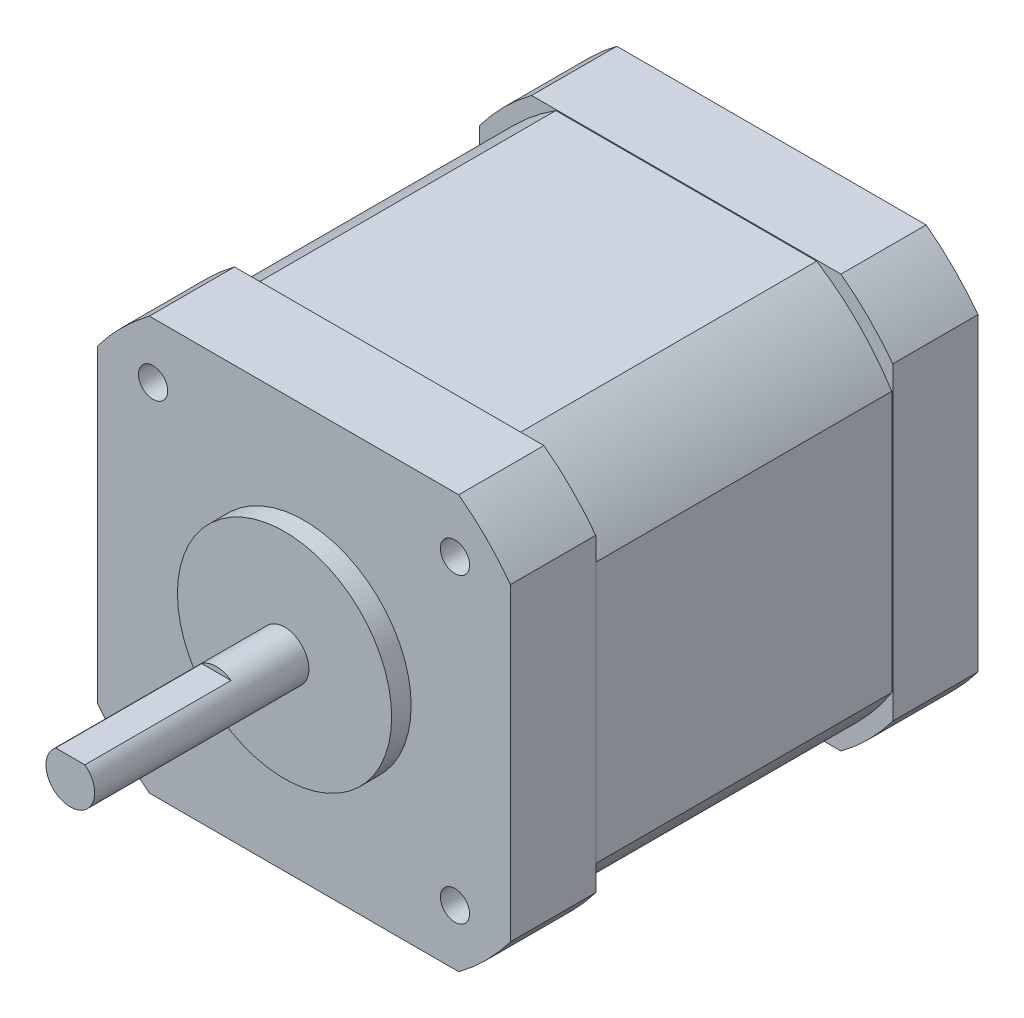
from build123d import *

# Parameters (mm, degrees)
BOSS_EXTRUDE1_DEPTH             = 8.75
BOSS_EXTRUDE2_DEPTH             = 30.5
BOSS_EXTRUDE3_DEPTH             = 8.75
SKETCH4_R                       = 11
BOSS_EXTRUDE4_DEPTH             = 2
SKETCH5_R                       = 2.5
BOSS_EXTRUDE5_DEPTH             = 22
CUT_EXTRUDE1_START              = -15
CUT_EXTRUDE1_DEPTH              = 15
M3X0_5_TAPPED_HOLE1_D           = 2.5
M3X0_5_TAPPED_HOLE1_DEPTH       = 7.5
M3X0_5_TAPPED_HOLE1_CBORE_D     = 3
M3X0_5_TAPPED_HOLE1_CBORE_DEPTH = 6
M3X0_5_TAPPED_HOLE1_TIP         = 0.751075774


with BuildPart() as part:
    # Sketch1 → Boss-Extrude1 (new body)
    with BuildSketch(Plane.XY):
        with BuildLine():
            Line((-21.209, 15.887992919), (-21.209, -15.887992919))
            ThreePointArc((-21.209, -15.887992919), (-18.738329701, -18.738329701), (-15.887992919, -21.209))
            Line((-15.887992919, -21.209), (15.887992919, -21.209))
            ThreePointArc((15.887992919, -21.209), (18.738329701, -18.738329701), (21.209, -15.887992919))
            Line((21.209, -15.887992919), (21.209, 15.887992919))
            ThreePointArc((21.209, 15.887992919), (18.738329701, 18.738329701), (15.887992919, 21.209))
            Line((15.887992919, 21.209), (-15.887992919, 21.209))
            ThreePointArc((-15.887992919, 21.209), (-18.738329701, 18.738329701), (-21.209, 15.887992919))
        make_face()
    extrude(amount=-BOSS_EXTRUDE1_DEPTH)

    # Sketch2 → Boss-Extrude2 (add)
    with BuildSketch(Plane(origin=(0, 0, -8.75), x_dir=(-1, 0, 0), z_dir=(0, 0, -1))):
        with BuildLine():
            Line((-13.394406258, 21.109), (13.394406258, 21.109))
            ThreePointArc((13.394406258, 21.109), (17.67766953, 17.67766953), (21.109, 13.394406258))
            Line((21.109, 13.394406258), (21.109, -13.394406258))
            ThreePointArc((21.109, -13.394406258), (17.67766953, -17.67766953), (13.394406258, -21.109))
            Line((13.394406258, -21.109), (-13.394406258, -21.109))
            ThreePointArc((-13.394406258, -21.109), (-17.67766953, -17.67766953), (-21.109, -13.394406258))
            Line((-21.109, -13.394406258), (-21.109, 13.394406258))
            ThreePointArc((-21.109, 13.394406258), (-17.67766953, 17.67766953), (-13.394406258, 21.109))
        make_face()
    extrude(amount=BOSS_EXTRUDE2_DEPTH)

    # Sketch3 → Boss-Extrude3 (add)
    with BuildSketch(Plane.XY.offset(-39.25)):
        with BuildLine():
            Line((-15.887992919, -21.209), (15.887992919, -21.209))
            ThreePointArc((15.887992919, -21.209), (18.738329701, -18.738329701), (21.209, -15.887992919))
            Line((21.209, -15.887992919), (21.209, 15.887992919))
            ThreePointArc((21.209, 15.887992919), (18.738329701, 18.738329701), (15.887992919, 21.209))
            Line((15.887992919, 21.209), (-15.887992919, 21.209))
            ThreePointArc((-15.887992919, 21.209), (-18.738329701, 18.738329701), (-21.209, 15.887992919))
            Line((-21.209, 15.887992919), (-21.209, -15.887992919))
            ThreePointArc((-21.209, -15.887992919), (-18.738329701, -18.738329701), (-15.887992919, -21.209))
        make_face()
    extrude(amount=-BOSS_EXTRUDE3_DEPTH)

    # Sketch4 → Boss-Extrude4 (add)
    with BuildSketch(Plane.XY):
        Circle(SKETCH4_R)
    extrude(amount=BOSS_EXTRUDE4_DEPTH)

    # Sketch5 → Boss-Extrude5 (add)
    with BuildSketch(Plane.XY.offset(2)):
        Circle(SKETCH5_R)
    extrude(amount=BOSS_EXTRUDE5_DEPTH)

    # Sketch6 → Cut-Extrude1 (cut)
    with BuildSketch(Plane.XY.offset(24).offset(CUT_EXTRUDE1_START)):
        with BuildLine():
            Line((-1.5, 2), (1.5, 2))
            ThreePointArc((1.5, 2), (0, 2.5), (-1.5, 2))
        make_face()
    extrude(amount=CUT_EXTRUDE1_DEPTH, mode=Mode.SUBTRACT)

    # M3x0.5 Tapped Hole1
    with Locations(Plane.XY):
        with Locations((-15.5, 15.5), (-15.5, -15.5), (15.5, -15.5), (15.5, 15.5)):
            CounterBoreHole(M3X0_5_TAPPED_HOLE1_D / 2, M3X0_5_TAPPED_HOLE1_CBORE_D / 2, M3X0_5_TAPPED_HOLE1_CBORE_DEPTH, depth=M3X0_5_TAPPED_HOLE1_DEPTH)
            with Locations((0, 0, -(M3X0_5_TAPPED_HOLE1_DEPTH + M3X0_5_TAPPED_HOLE1_TIP / 2))):  # 118° drill point
                Cone(0, M3X0_5_TAPPED_HOLE1_D / 2, M3X0_5_TAPPED_HOLE1_TIP, mode=Mode.SUBTRACT)


solid = part.part
